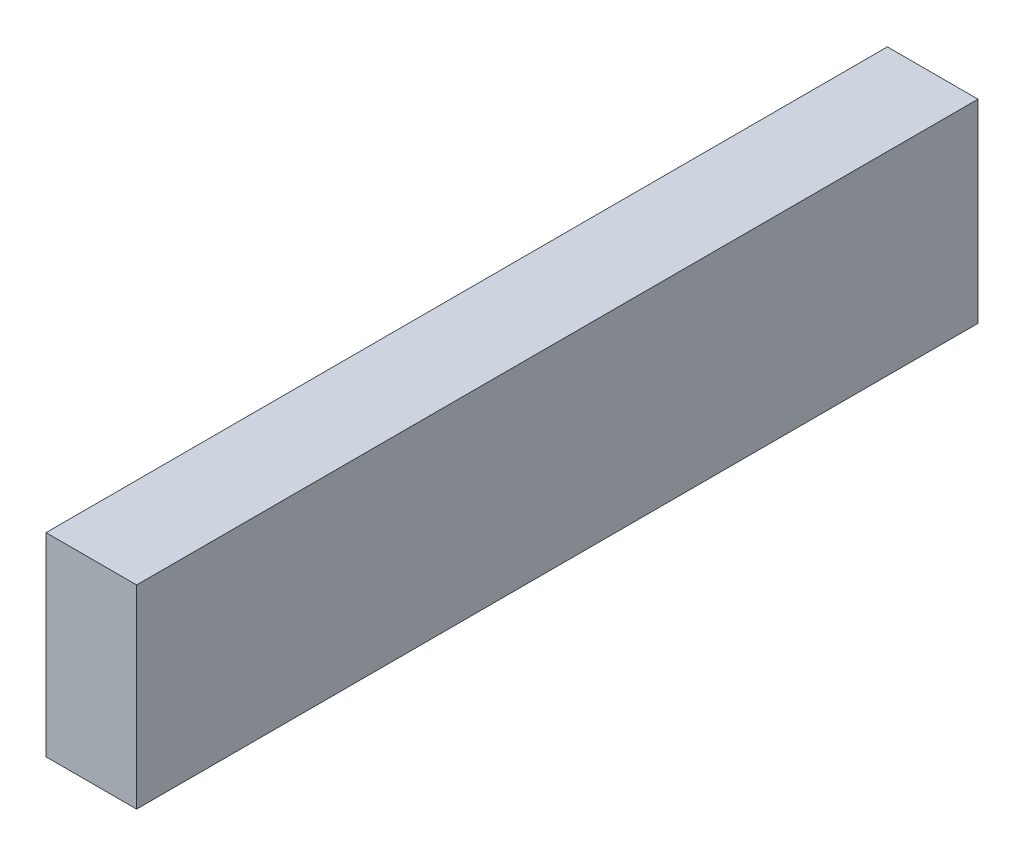
from build123d import *

# Parameters (mm, degrees)
SKETCH1_W           = 7
SKETCH1_H           = 15
BOSS_EXTRUDE1_DEPTH = 65


with BuildPart() as part:
    # Sketch1 → Boss-Extrude1 (new body)
    with BuildSketch(Plane.XY):
        with Locations((-51.142857143, 12.589285714)):
            Rectangle(SKETCH1_W, SKETCH1_H)
    extrude(amount=BOSS_EXTRUDE1_DEPTH)


solid = part.part
